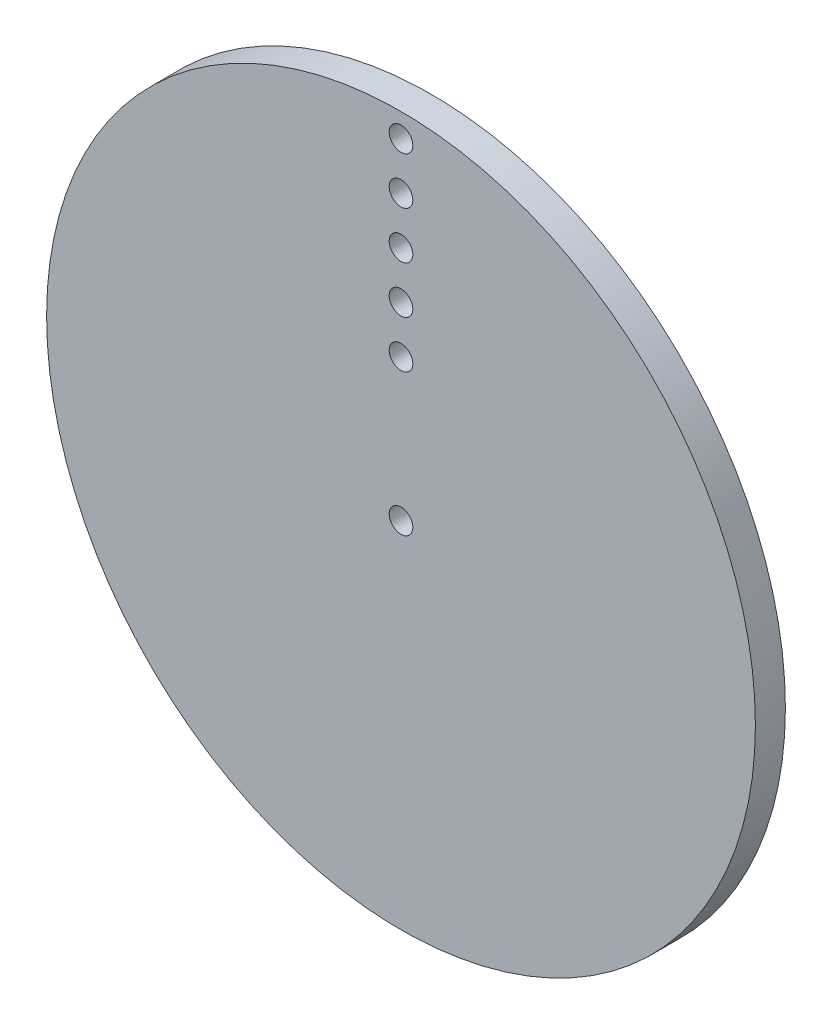
from build123d import *

# Parameters (mm, degrees)
SKETCH1_R           = 75
SKETCH1_R_2         = 2.5
BOSS_EXTRUDE1_DEPTH = 6.35


with BuildPart() as part:
    # Sketch1 → Boss-Extrude1 (new body)
    with BuildSketch(Plane.XY):
        Circle(SKETCH1_R)
        with Locations((0, 30)):
            Circle(SKETCH1_R_2, mode=Mode.SUBTRACT)
        with Locations((0, 40)):
            Circle(SKETCH1_R_2, mode=Mode.SUBTRACT)
        with Locations((0, 50)):
            Circle(SKETCH1_R_2, mode=Mode.SUBTRACT)
        with Locations((0, 60)):
            Circle(SKETCH1_R_2, mode=Mode.SUBTRACT)
        with Locations((0, 70)):
            Circle(SKETCH1_R_2, mode=Mode.SUBTRACT)
        Circle(SKETCH1_R_2, mode=Mode.SUBTRACT)
    extrude(amount=BOSS_EXTRUDE1_DEPTH)


solid = part.part
